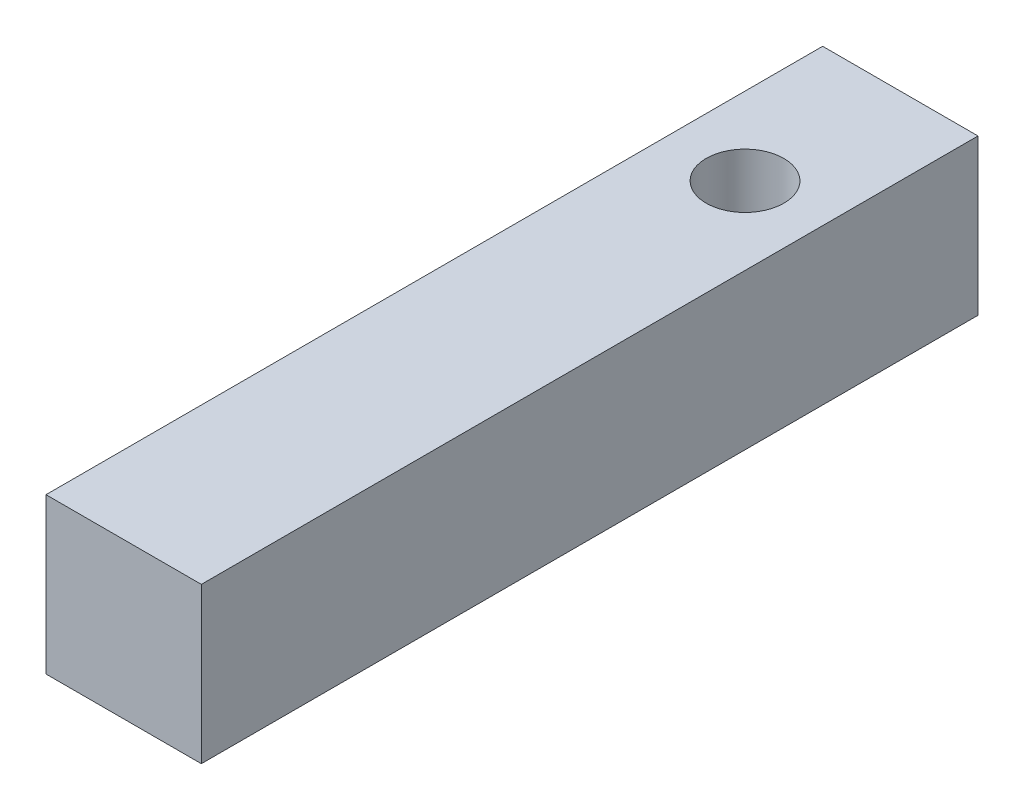
from build123d import *

# Parameters (mm, degrees)
SKETCH1_W           = 30
SKETCH1_H           = 30
BOSS_EXTRUDE1_DEPTH = 150
SKETCH2_R           = 7.5
CUT_EXTRUDE1_DEPTH  = 150


with BuildPart() as part:
    # Sketch1 → Boss-Extrude1 (new body)
    with BuildSketch(Plane.XY):
        Rectangle(SKETCH1_W, SKETCH1_H)
    extrude(amount=BOSS_EXTRUDE1_DEPTH)

    # Sketch2 → Cut-Extrude1 (cut)
    with BuildSketch(Plane.XZ.offset(15)):
        with Locations(Location((0, 30, 0), (0, 0, 270))):
            Circle(SKETCH2_R)
    extrude(amount=-CUT_EXTRUDE1_DEPTH, mode=Mode.SUBTRACT)


solid = part.part
